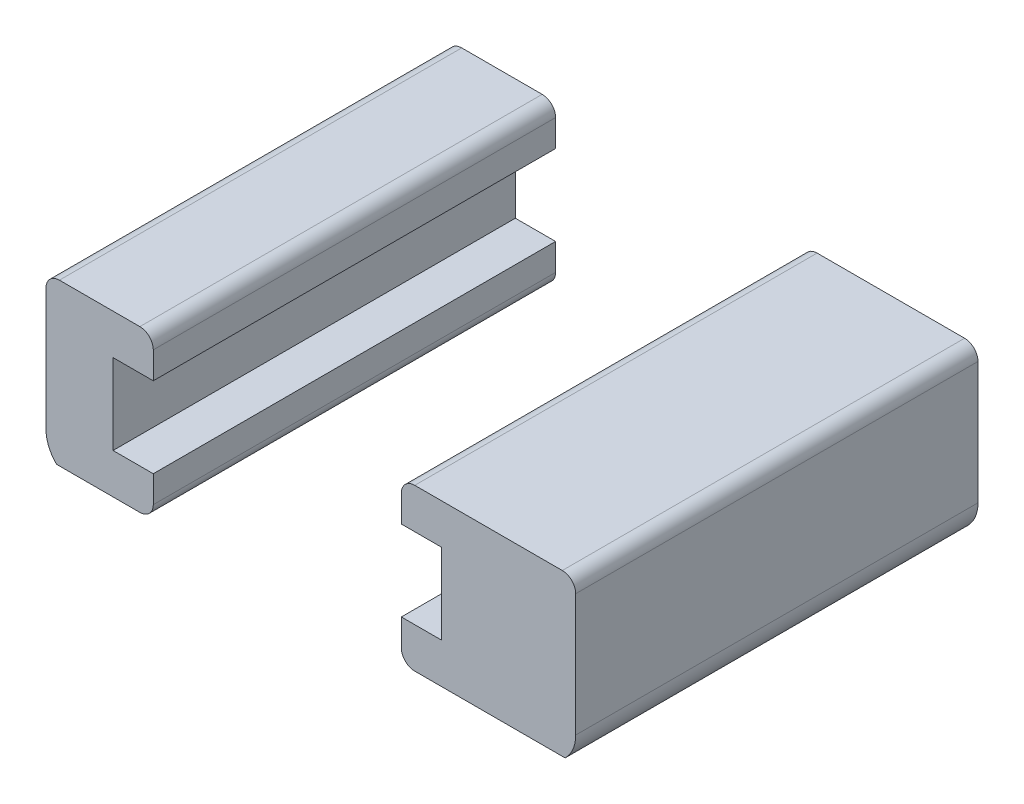
from build123d import *

# Parameters (mm, degrees)
BOSS_EXTRUDE1_DEPTH     = 30
BOSS_EXTRUDE1_2_DEPTH   = 30
FILLET1_R               = 2
FILLET2_R               = 2
CUT_EXTRUDE1_DEPTH      = 77.839117642
CUT_EXTRUDE1_DEPTH_BACK = 77.839117642


with BuildPart() as part:
    # Sketch1 → Boss-Extrude1 (new, symmetric)
    with BuildSketch(Plane.XY):
        Polygon((18.5, 18), (44.5, 18), (44.5, -6), (18.5, -6), (18.5, 0), (24.5, 0), (24.5, 12), (18.5, 12), align=None)
    extrude(amount=BOSS_EXTRUDE1_DEPTH, both=True)

    # Fillet2
    fillet2_edges = [part.edges().sort_by_distance(p)[0] for p in [
        (18.5, 18, 0),
        (44.5, 18, 0),
        (18.5, -6, 0),
    ]]
    fillet(fillet2_edges, radius=FILLET2_R)


with BuildPart() as body_2:
    # Sketch1 → Boss-Extrude1 2 (new, symmetric)
    with BuildSketch(Plane.XY):
        Polygon((-34.5, 18), (-34.5, -6), (-18.5, -6), (-18.5, 0), (-24.5, 0), (-24.5, 12), (-18.5, 12), (-18.5, 18), align=None)
    extrude(amount=BOSS_EXTRUDE1_2_DEPTH, both=True)

    # Fillet1
    fillet1_edges = [body_2.edges().sort_by_distance(p)[0] for p in [
        (-18.5, -6, 0),
        (-34.5, 18, 0),
        (-18.5, 18, 0),
    ]]
    fillet(fillet1_edges, radius=FILLET1_R)


with BuildPart() as cut_extrude1_tool:
    # Sketch2 → Cut-Extrude1 (new, two sides: drawn at the far end of the back side and taken through both)
    with BuildSketch(Plane(origin=(0, 0, -30), x_dir=(-1, 0, 0), z_dir=(0, 0, -1)).offset(-CUT_EXTRUDE1_DEPTH_BACK)):
        with BuildLine():
            Line((-44.5, -2.256209937), (-44.5, -6))
            Line((-44.5, -6), (-42.919986213, -6))
            add(Edge.make_bspline(
                [(-44.5, -2.256209937), (-44.5, -4.479366821), (-42.919986213, -6)],
                knots=[4.71238898, 4.71238898, 4.71238898, 5.529957107, 5.529957107, 5.529957107], degree=2, weights=[1, 0.917604829, 1]))
        make_face()
        with BuildLine():
            Line((32.919986213, -6), (34.5, -6))
            Line((34.5, -6), (34.5, -2.256209937))
            add(Edge.make_bspline(
                [(32.919986213, -6), (34.5, -4.479366821), (34.5, -2.256209937)],
                knots=[3.894820854, 3.894820854, 3.894820854, 4.71238898, 4.71238898, 4.71238898], degree=2, weights=[1, 0.917604829, 1]))
        make_face()
    extrude(amount=CUT_EXTRUDE1_DEPTH + CUT_EXTRUDE1_DEPTH_BACK)


with BuildPart() as part_1:
    add(part.part)

    # Cut-Extrude1: cut by cut_extrude1_tool
    add(cut_extrude1_tool.part, mode=Mode.SUBTRACT)


with BuildPart() as body_2_1:
    add(body_2.part)

    # Cut-Extrude1: cut by cut_extrude1_tool
    add(cut_extrude1_tool.part, mode=Mode.SUBTRACT)


solid = Compound([part_1.part, body_2_1.part])
